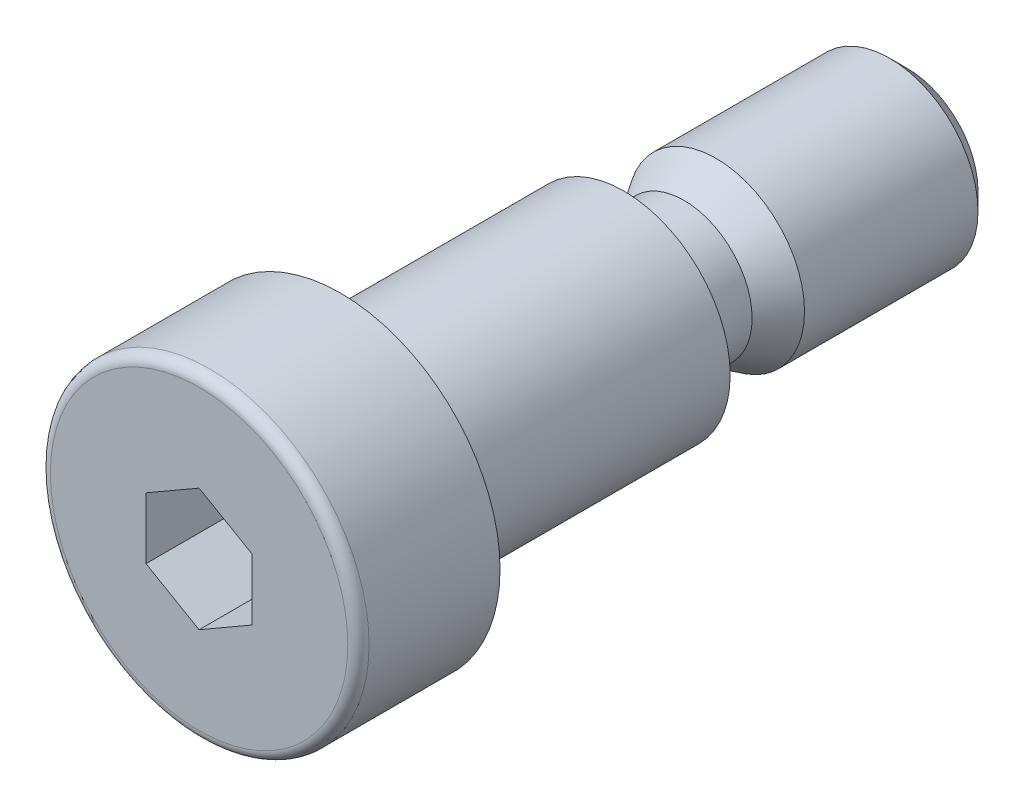
from build123d import *

# Parameters (mm, degrees)
SZKIC1_W                   = 3.85
SZKIC1_H                   = 3.39
WYTNIJ_WYCI_GNI_CIE1_DEPTH = 4.9
ZAOKR_GLENIE1_R            = 0.6


with BuildPart() as part:
    # Szkic1 → Obrót1 (revolve)
    with BuildSketch(Plane(origin=(0, 0, 0), x_dir=(1, 0, 0), z_dir=(0, 1, 0)), mode=Mode.PRIVATE) as obr_t1_sk:
        Polygon((0, -16), (0, -8), (-6, -8), (-9, -8), (-9, -16), align=None)
        Polygon((0, -8), (0, 8), (-3.85, 8), (-6, 8), (-6, -8), align=None)
        with Locations((-1.925, 9.695)):
            Rectangle(SZKIC1_W, SZKIC1_H)
        Polygon((-3.85, 11.39), (0, 11.39), (0, 24), (-4, 24), (-5, 23), (-5, 13.2), align=None)
    revolve(obr_t1_sk.sketch.rotate(Axis((0, 0, 16), (0, 0, -1)), 180), axis=Axis((0, 0, 16), (0, 0, -1)))

    # Szkic2 → Wytnij-wyciągnięcie1 (cut)
    with BuildSketch(Plane.XY.offset(16)):
        Polygon((3, 1.732050808), (0, 3.464101615), (-3, 1.732050808), (-3, -1.732050808), (0, -3.464101615), (3, -1.732050808), align=None)
    extrude(amount=-WYTNIJ_WYCI_GNI_CIE1_DEPTH, mode=Mode.SUBTRACT)

    # Zaokrąglenie1
    zaokr_glenie1_edges = [part.edges().sort_by_distance(p)[0] for p in [
        (-9, 0, 16),
    ]]
    fillet(zaokr_glenie1_edges, radius=ZAOKR_GLENIE1_R)


solid = part.part
